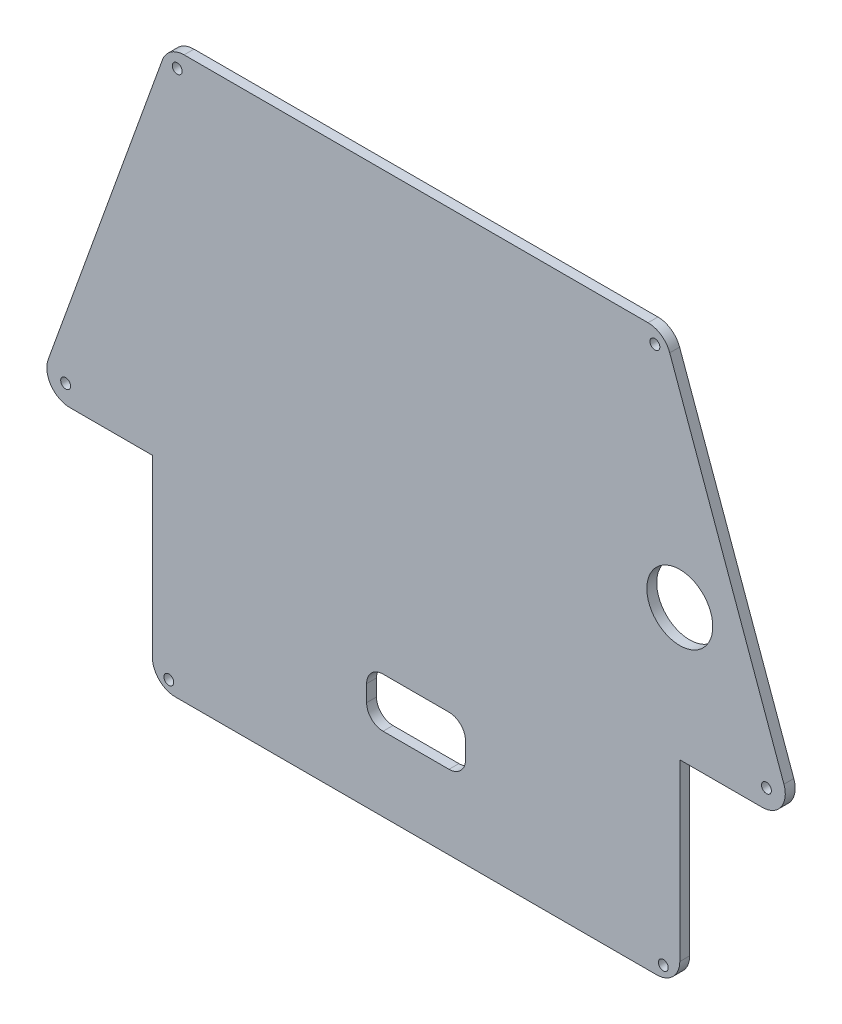
from build123d import *

# Parameters (mm, degrees)
SKETCH_2_R      = 10
SKETCH_2_R_2    = 1.5
EXTRUDE_2_DEPTH = 3


with BuildPart() as part:
    # 草图2 → 凸台-拉伸2 (new body)
    with BuildSketch(Plane.XY):
        with BuildLine():
            Line((-73, 0), (73, 0))
            ThreePointArc((73, 0), (77.949747468, 2.050252532), (80, 7))
            Line((80, 7), (80, 60))
            Line((80, 60), (105, 60))
            ThreePointArc((105, 60), (110.7284389, 62.976942983), (111.584524662, 69.375717782))
            Line((111.584524662, 69.375717782), (76.947414353, 165.375717782))
            ThreePointArc((76.947414353, 165.375717782), (74.385946708, 168.7284389), (70.362889691, 170))
            Line((70.362889691, 170), (-70.362889691, 170))
            ThreePointArc((-70.362889691, 170), (-74.385946708, 168.7284389), (-76.947414353, 165.375717782))
            Line((-76.947414353, 165.375717782), (-111.584524662, 69.375717782))
            ThreePointArc((-111.584524662, 69.375717782), (-110.7284389, 62.976942983), (-105, 60))
            Line((-105, 60), (-80, 60))
            Line((-80, 60), (-80, 7))
            ThreePointArc((-80, 7), (-77.949747468, 2.050252532), (-73, 0))
        make_face()
        with Locations((80, 100)):
            Circle(SKETCH_2_R, mode=Mode.SUBTRACT)
        with Locations((-72.441382232, 165.375717782)):
            Circle(SKETCH_2_R_2, mode=Mode.SUBTRACT)
        with Locations((-106.29148568, 65.75613767)):
            Circle(SKETCH_2_R_2, mode=Mode.SUBTRACT)
        with Locations(Location((106.29148568, 65.75613767, 0), (0, 0, 180))):
            Circle(SKETCH_2_R_2, mode=Mode.SUBTRACT)
        with Locations(Location((72.441382232, 165.375717782, 0), (0, 0, 180))):
            Circle(SKETCH_2_R_2, mode=Mode.SUBTRACT)
        with Locations((-75, 3.552033702)):
            Circle(SKETCH_2_R_2, mode=Mode.SUBTRACT)
        with Locations(Location((75, 3.552033702, 0), (0, 0, 180))):
            Circle(SKETCH_2_R_2, mode=Mode.SUBTRACT)
        with BuildLine():
            Line((-10, 22.5), (10, 22.5))
            ThreePointArc((10, 22.5), (13.535533906, 23.964466094), (15, 27.5))
            Line((15, 27.5), (15, 32.5))
            ThreePointArc((15, 32.5), (13.535533906, 36.035533906), (10, 37.5))
            Line((10, 37.5), (-10, 37.5))
            ThreePointArc((-10, 37.5), (-13.535533906, 36.035533906), (-15, 32.5))
            Line((-15, 32.5), (-15, 27.5))
            ThreePointArc((-15, 27.5), (-13.535533906, 23.964466094), (-10, 22.5))
        make_face(mode=Mode.SUBTRACT)
    extrude(amount=EXTRUDE_2_DEPTH)


solid = part.part
